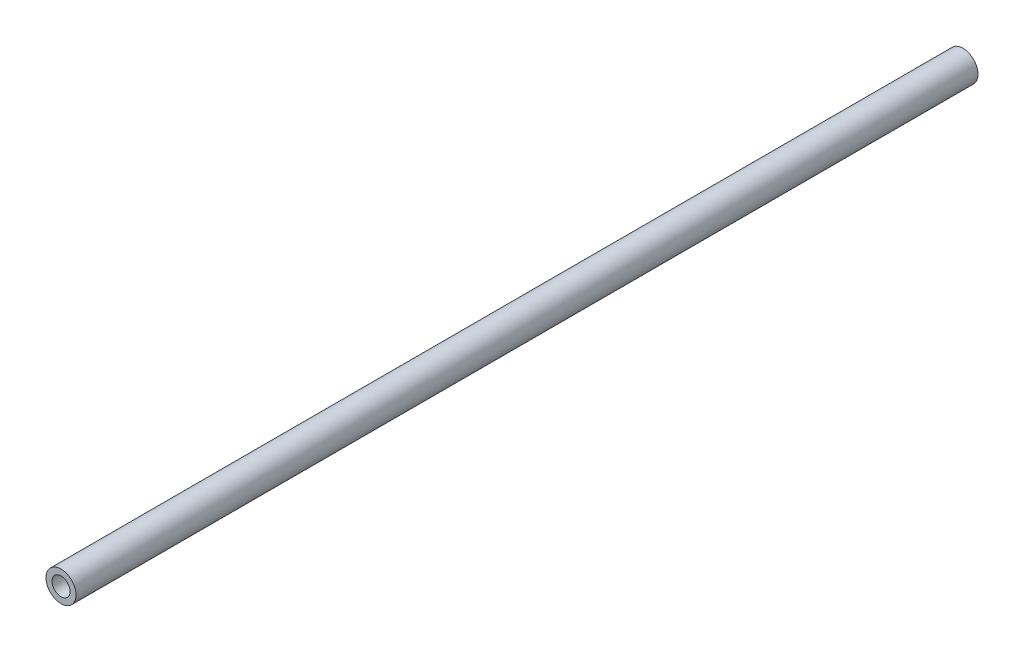
from build123d import *

# Parameters (mm, degrees)
ESQUISSE1_R        = 2.5
ESQUISSE1_R_2      = 1.5
BOSS_EXTRU_1_DEPTH = 150


with BuildPart() as part:
    # Esquisse1 → Boss.-Extru.1 (new body)
    with BuildSketch(Plane.XY):
        Circle(ESQUISSE1_R)
        Circle(ESQUISSE1_R_2, mode=Mode.SUBTRACT)
    extrude(amount=BOSS_EXTRU_1_DEPTH)


solid = part.part
